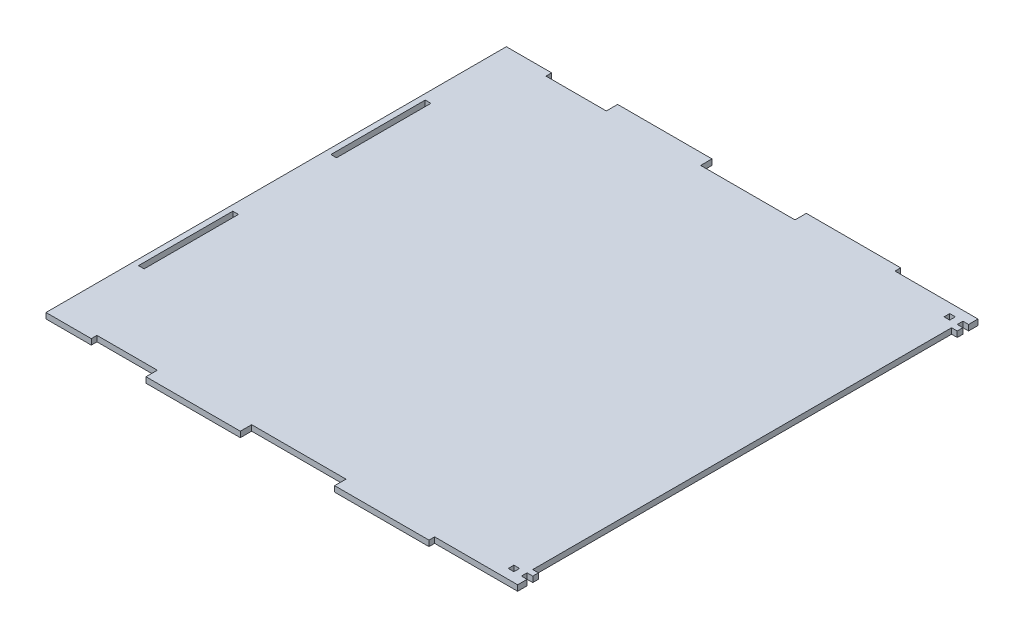
from build123d import *

# Parameters (mm, degrees)
SKETCH1_W           = 3
SKETCH1_H           = 50
SKETCH1_H_2         = 3
BOSS_EXTRUDE1_DEPTH = 3


with BuildPart() as part:
    # Sketch1 → Boss-Extrude1 (new body)
    with BuildSketch(Plane(origin=(0, 0, 0), x_dir=(1, 0, 0), z_dir=(0, 1, 0))):
        Polygon((247, -244), (247, -239), (244, -239), (244, -236), (247, -236), (247, -233), (244, -233), (244, -11), (247, -11), (247, -8), (244, -8), (244, -5), (247, -5), (247, 0), (203, 0), (203, 3), (153, 3), (153, -3), (103, -3), (103, 3), (53, 3), (53, -3), (21, -3), (21, 0), (0, 0), (-3, 0), (-3, -244), (0, -244), (21, -244), (21, -241), (53, -241), (53, -247), (103, -247), (103, -241), (153, -241), (153, -247), (203, -247), (203, -244), align=None)
        with Locations((1.5, -173)):
            Rectangle(SKETCH1_W, SKETCH1_H, mode=Mode.SUBTRACT)
        with Locations((238.5, -6.5)):
            Rectangle(SKETCH1_W, SKETCH1_H_2, mode=Mode.SUBTRACT)
        with Locations((1.5, -71)):
            Rectangle(SKETCH1_W, SKETCH1_H, mode=Mode.SUBTRACT)
        with Locations((238.5, -237.5)):
            Rectangle(SKETCH1_W, SKETCH1_H_2, mode=Mode.SUBTRACT)
    extrude(amount=BOSS_EXTRUDE1_DEPTH)


solid = part.part
